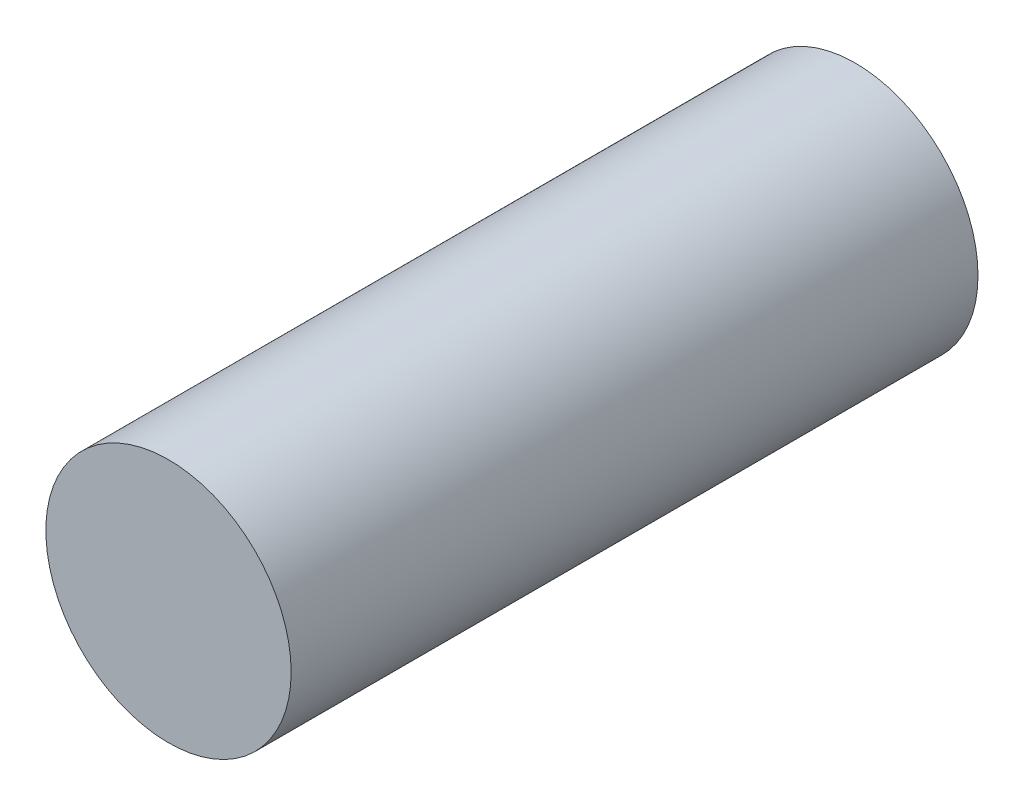
from build123d import *

# Parameters (mm, degrees)
ESQUISSE1_R        = 2.5
BOSS_EXTRU_1_DEPTH = 14


with BuildPart() as part:
    # Esquisse1 → Boss.-Extru.1 (new body)
    with BuildSketch(Plane.XY):
        Circle(ESQUISSE1_R)
    extrude(amount=BOSS_EXTRU_1_DEPTH)


solid = part.part
